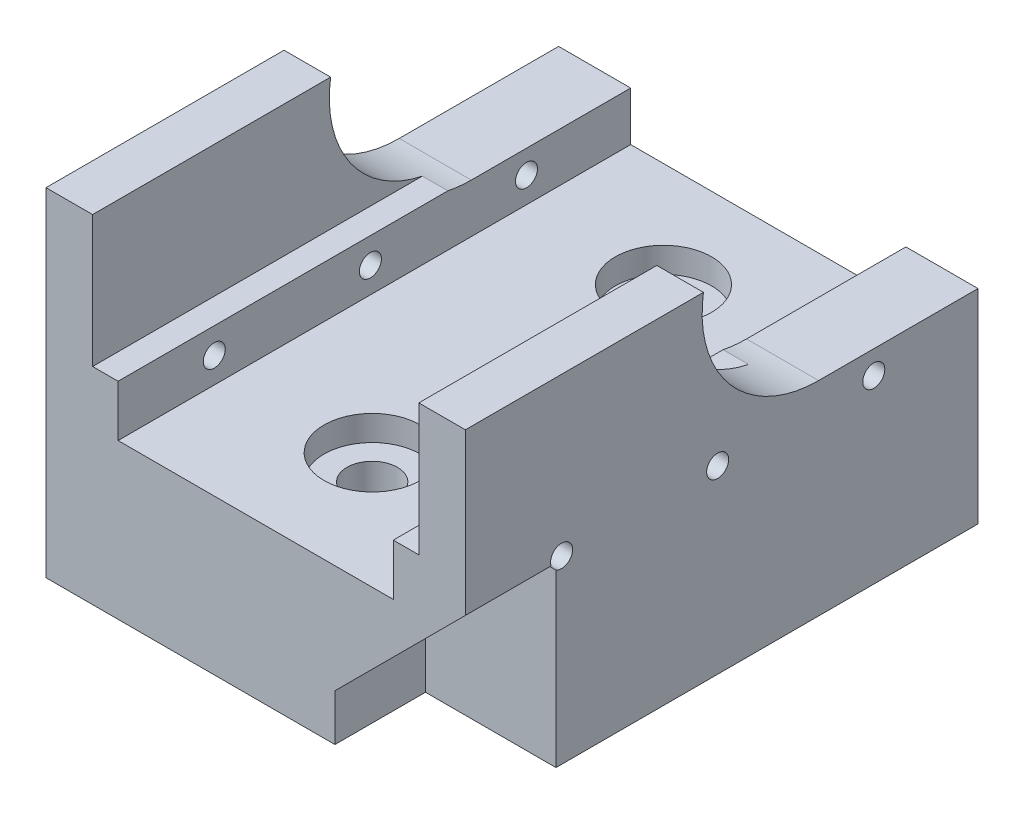
from build123d import *

# Parameters (mm, degrees)
SKETCH1_W                       = 45.72
SKETCH1_H                       = 60.96
BOSS_EXTRUDE1_DEPTH             = 6.35
SKETCH2_W                       = 7.8600046
SKETCH2_H                       = 60.96
BOSS_EXTRUDE2_DEPTH             = 20.955
LPATTERN1_COUNT                 = 3
LPATTERN1_PITCH                 = 17.018
SKETCH1_3_W                     = 45.72
SKETCH1_3_H                     = 60.96
BOSS_EXTRUDE3_DEPTH             = 2.54
CUT_EXTRUDE1_START              = 14.999995
SKETCH11_W                      = 60.96
SKETCH11_H                      = 14.3449802
CUT_EXTRUDE1_DEPTH              = 17.78
CUT_EXTRUDE2_DEPTH              = 62.358877312
SKETCH17_W                      = 45.72
SKETCH17_H                      = 60.96
BOSS_EXTRUDE4_DEPTH             = 6.985
SKETCH19_W                      = 29.9999908
SKETCH19_H                      = 60.96
BOSS_EXTRUDE5_DEPTH             = 1.0100056
CBORE_FOR_M5_SBHCS2_D           = 5.5
CBORE_FOR_M5_SBHCS2_CBORE_D     = 10.5
CBORE_FOR_M5_SBHCS2_CBORE_DEPTH = 2.75
CUT_EXTRUDE3_DEPTH              = 82.222264916
CUT_EXTRUDE3_DEPTH_BACK         = 82.222264916
SKETCH24_W                      = 5.08
SKETCH24_H                      = 45.72
CUT_EXTRUDE4_DEPTH              = 9.874000032


with BuildPart() as part:
    # Sketch1 → Boss-Extrude1 (new body)
    with BuildSketch(Plane(origin=(0, 0, 0), x_dir=(1, 0, 0), z_dir=(0, 1, 0))):
        Rectangle(SKETCH1_W, SKETCH1_H)
    extrude(amount=BOSS_EXTRUDE1_DEPTH)

    # Sketch2 → Boss-Extrude2 (add)
    with BuildSketch(Plane(origin=(0, 6.35, 0), x_dir=(1, 0, 0), z_dir=(0, 1, 0))):
        with Locations((-18.9299977, 0)):
            Rectangle(SKETCH2_W, SKETCH2_H)
        with Locations((18.9299977, 0)):
            Rectangle(SKETCH2_W, SKETCH2_H)
    extrude(amount=BOSS_EXTRUDE2_DEPTH)

    # Sketch7 → M2 Clearance Hole2 (revolve, cut)
    with BuildSketch(Plane(origin=(22.86, 10.16, 14.9171914), x_dir=(0, 0, -1), z_dir=(0, 1, 0))):
        Polygon((0, 0), (0, 46.441032743), (1.2, 45.72), (1.2, 0), align=None)
    m2_clearance_hole2 = revolve(axis=Axis((29.21, 10.16, 14.9171914), (-1, 0, 0)), mode=Mode.SUBTRACT)

    # LPattern1: M2 Clearance Hole2 ×3
    with Locations(*[(0, 0, -i * LPATTERN1_PITCH) for i in range(1, LPATTERN1_COUNT)]):
        add(m2_clearance_hole2, mode=Mode.SUBTRACT)

    # Sketch1<3> → Boss-Extrude3 (add)
    with BuildSketch(Plane(origin=(0, 0, 0), x_dir=(1, 0, 0), z_dir=(0, 1, 0))):
        Rectangle(SKETCH1_3_W, SKETCH1_3_H)
    extrude(amount=-BOSS_EXTRUDE3_DEPTH)

    # Sketch11 → Cut-Extrude1 (cut, symmetric)
    with BuildSketch(Plane.ZY.offset(-14.9999954).offset(CUT_EXTRUDE1_START)):
        with Locations((0, 20.1325099)):
            Rectangle(SKETCH11_W, SKETCH11_H)
    extrude(amount=CUT_EXTRUDE1_DEPTH, both=True, mode=Mode.SUBTRACT)

    # Sketch12 → Cut-Extrude2 (cut, through all)
    with BuildSketch(Plane(origin=(22.86, 0, 0), x_dir=(0, 0, -1), z_dir=(1, 0, 0))):
        with BuildLine():
            Line((13.105000048, 12.7), (30.48, 12.7))
            Line((30.48, 12.7), (30.48, 27.305))
            Line((30.48, 27.305), (25.661312206, 27.305))
            ThreePointArc((25.661312206, 27.305), (3.474748234, 33.679387055), (13.105000048, 12.7))
        make_face()
    extrude(amount=-CUT_EXTRUDE2_DEPTH, mode=Mode.SUBTRACT)

    # Sketch17 → Boss-Extrude4 (add)
    with BuildSketch(Plane.XZ.offset(2.54)):
        Rectangle(SKETCH17_W, SKETCH17_H)
    extrude(amount=BOSS_EXTRUDE4_DEPTH)

    # Sketch19 → Boss-Extrude5 (add)
    with BuildSketch(Plane(origin=(0, 6.35, 0), x_dir=(1, 0, 0), z_dir=(0, 1, 0))):
        Rectangle(SKETCH19_W, SKETCH19_H)
    extrude(amount=BOSS_EXTRUDE5_DEPTH)

    # CBORE for M5 SBHCS2 (through all)
    with Locations(Plane(origin=(0, 7.3600056, 0), x_dir=(1, 0, 0), z_dir=(0, 1, 0))):
        with Locations((0, -12.7), (0, 19.05)):
            CounterBoreHole(CBORE_FOR_M5_SBHCS2_D / 2, CBORE_FOR_M5_SBHCS2_CBORE_D / 2, CBORE_FOR_M5_SBHCS2_CBORE_DEPTH)

    # Sketch24 → Cut-Extrude3 (cut, two sides: drawn at the far end of the back side and taken through both)
    with BuildSketch(Plane(origin=(31.571183672, -12.7, -14.6188086), x_dir=(0, 0, -1), z_dir=(0, 1, 0)).offset(-CUT_EXTRUDE3_DEPTH_BACK)):
        with Locations((-42.5588086, 31.571183672)):
            Rectangle(SKETCH24_W, SKETCH24_H)
    extrude(amount=CUT_EXTRUDE3_DEPTH + CUT_EXTRUDE3_DEPTH_BACK, mode=Mode.SUBTRACT)

    # Sketch25 → Cut-Extrude4 (cut)
    with BuildSketch(Plane.XY.offset(25.4)):
        Polygon((8.636, -9.525), (8.636, -4.445), (22.86, 9.779), (22.86, -9.525), align=None)
    extrude(amount=-CUT_EXTRUDE4_DEPTH, mode=Mode.SUBTRACT)


solid = part.part
